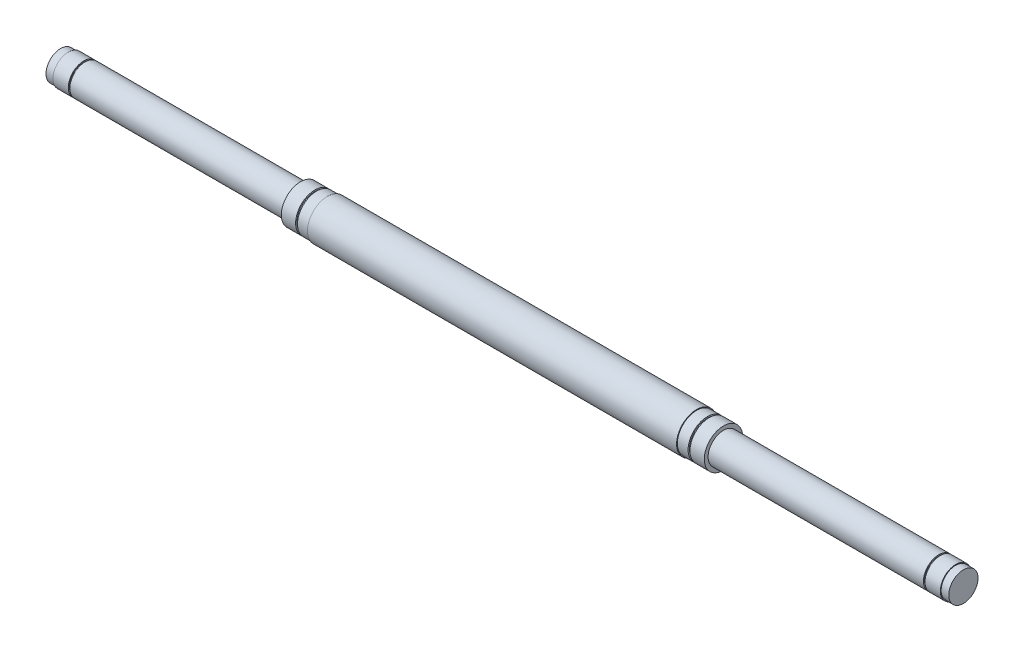
from build123d import *


with BuildPart() as part:
    # 草图1 → 旋转1 (revolve)
    with BuildSketch(Plane(origin=(0, 0, 0), x_dir=(1, 0, 0), z_dir=(0, 1, 0)), mode=Mode.PRIVATE) as revolve_1_sk:
        Polygon((0, 0), (0, 9.5), (5, 9.5), (5, 10), (15, 10), (15, 9.25), (16, 9.25), (16, 10), (156, 10), (156, 12.5), (165.3, 12.5), (165.3, 11.6), (166.5, 11.6), (166.5, 12.5), (173.5, 12.5), (173.5, 13), (413.5, 13), (413.5, 12.5), (420.5, 12.5), (420.5, 11.6), (421.7, 11.6), (421.7, 12.5), (431, 12.5), (431, 10), (571, 10), (571, 9.25), (572, 9.25), (572, 10), (582, 10), (582, 9.5), (587, 9.5), (587, 0), align=None)
    revolve(revolve_1_sk.sketch.rotate(Axis((-75.612934102, 0, 0), (1, 0, 0)), 180), axis=Axis((-75.612934102, 0, 0), (1, 0, 0)))


solid = part.part
